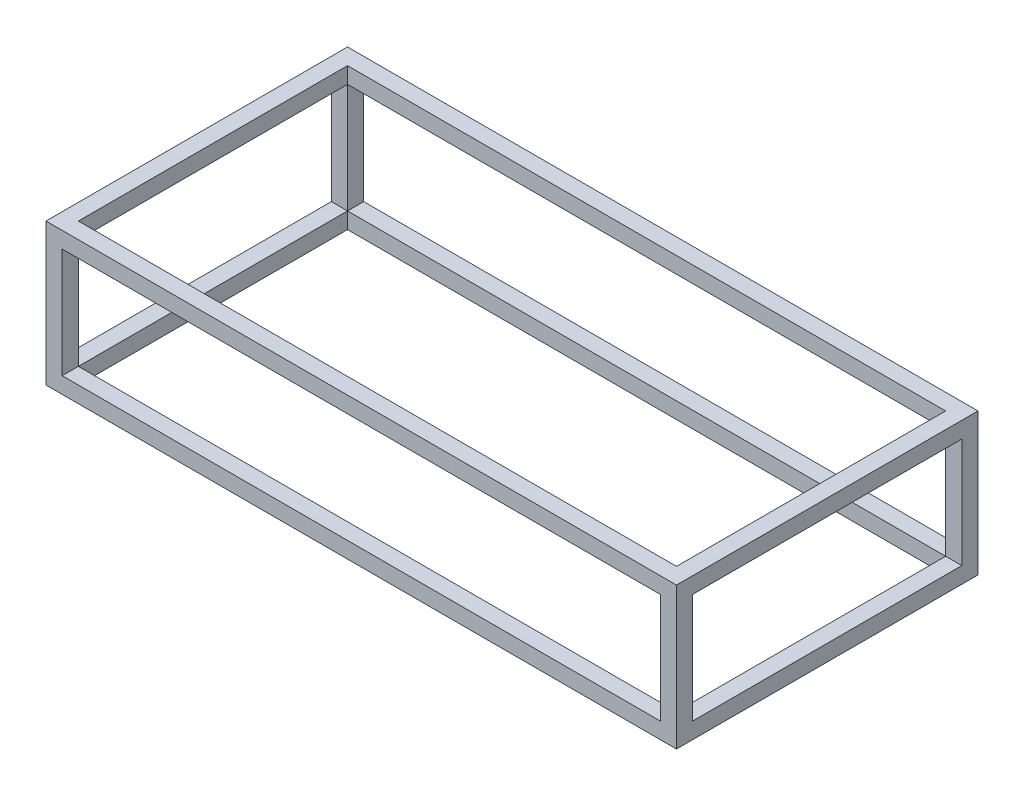
from build123d import *

# Parameters (mm, degrees)
SKETCH3_W           = 584.2
SKETCH3_H           = 279.4
SKETCH3_W_2         = 554.2
SKETCH3_H_2         = 249.4
BOSS_EXTRUDE3_DEPTH = 15
SKETCH4_W           = 15
SKETCH4_H           = 15
BOSS_EXTRUDE4_DEPTH = 101.6
SKETCH5_W           = 584.2
SKETCH5_H           = 279.4
SKETCH5_W_2         = 554.2
SKETCH5_H_2         = 249.4
BOSS_EXTRUDE6_DEPTH = 15


with BuildPart() as part:
    # Sketch3 → Boss-Extrude3 (new body)
    with BuildSketch(Plane(origin=(0, 0, 0), x_dir=(1, 0, 0), z_dir=(0, 1, 0))):
        Rectangle(SKETCH3_W, SKETCH3_H)
        Rectangle(SKETCH3_W_2, SKETCH3_H_2, mode=Mode.SUBTRACT)
    extrude(amount=BOSS_EXTRUDE3_DEPTH)

    # Sketch4 → Boss-Extrude4 (add)
    with BuildSketch(Plane(origin=(0, 15, 0), x_dir=(1, 0, 0), z_dir=(0, 1, 0))):
        with Locations((-284.6, 132.2)):
            Rectangle(SKETCH4_W, SKETCH4_H)
        with Locations((-284.6, -132.2)):
            Rectangle(SKETCH4_W, SKETCH4_H)
        with Locations((284.6, -132.2)):
            Rectangle(SKETCH4_W, SKETCH4_H)
        with Locations((284.6, 132.2)):
            Rectangle(SKETCH4_W, SKETCH4_H)
    extrude(amount=BOSS_EXTRUDE4_DEPTH)

    # Sketch5 → Boss-Extrude6 (add)
    with BuildSketch(Plane(origin=(0, 116.6, 0), x_dir=(1, 0, 0), z_dir=(0, 1, 0))):
        Rectangle(SKETCH5_W, SKETCH5_H)
        Rectangle(SKETCH5_W_2, SKETCH5_H_2, mode=Mode.SUBTRACT)
    extrude(amount=BOSS_EXTRUDE6_DEPTH)


solid = part.part
